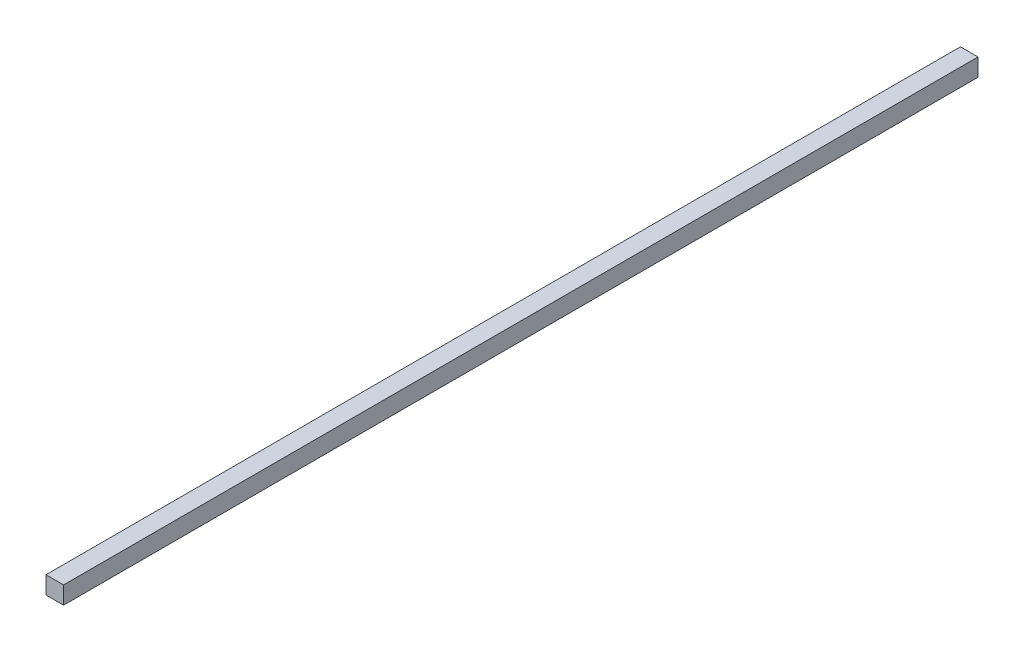
from build123d import *

# Parameters (mm, degrees)
SKETCH1_W           = 5
SKETCH1_H           = 5
BOSS_EXTRUDE1_DEPTH = 260


with BuildPart() as part:
    # Sketch1 → Boss-Extrude1 (new body)
    with BuildSketch(Plane.XY):
        Rectangle(SKETCH1_W, SKETCH1_H)
    extrude(amount=BOSS_EXTRUDE1_DEPTH)


solid = part.part
